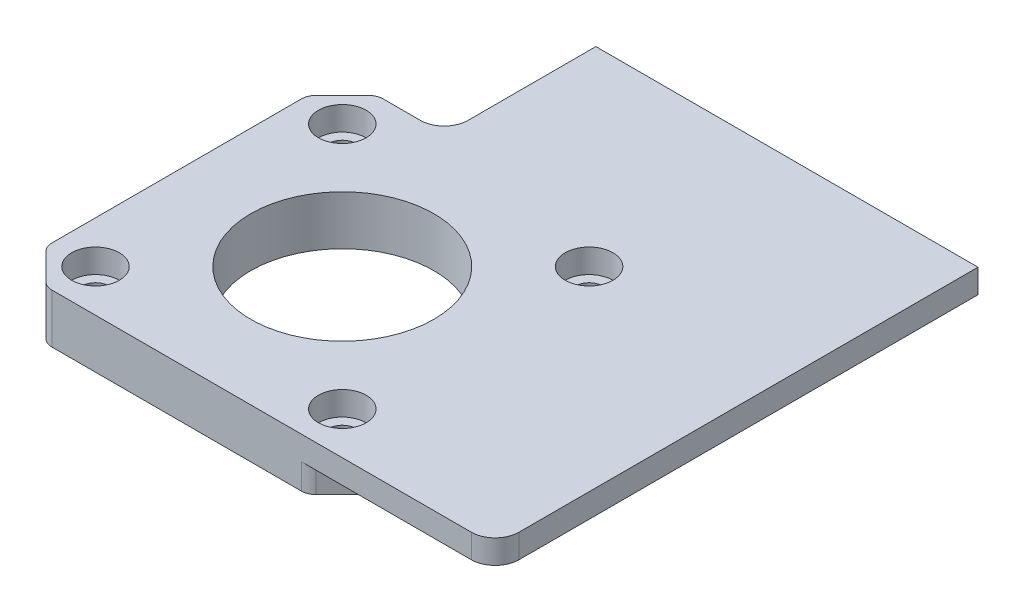
from build123d import *

# Parameters (mm, degrees)
SKETCH1_R           = 11.5
SKETCH1_R_2         = 1.75
BOSS_EXTRUDE1_DEPTH = 3.2
BOSS_EXTRUDE2_START = 3.2
SKETCH1_5_R         = 2.55
SKETCH1_5_R_2       = 11.5
SKETCH1_5_R_3       = 1.75
BOSS_EXTRUDE2_DEPTH = 3
BOSS_EXTRUDE3_START = 5
SKETCH1_6_R         = 2.55
BOSS_EXTRUDE3_DEPTH = 1.2
CUT_EXTRUDE2_START  = 3.2
SKETCH1_4_R         = 3
CUT_EXTRUDE2_DEPTH  = 3
FILLET1_R           = 3


with BuildPart() as part:
    # Sketch1 → Boss-Extrude1 (new body)
    with BuildSketch(Plane(origin=(0, -68.726755499, 0), x_dir=(1, 0, 0), z_dir=(0, 1, 0))):
        with BuildLine():
            Line((100.657671875, -32.65), (132.000817625, -32.65))
            ThreePointArc((132.000817625, -32.65), (132.689647804, -32.512983159), (133.273609832, -32.122792206))
            Line((133.273609832, -32.122792206), (136.602036956, -28.794365081))
            ThreePointArc((136.602036956, -28.794365081), (136.992227909, -28.210403054), (137.12924475, -27.521572875))
            Line((137.12924475, -27.521572875), (137.12924475, 3.821572875))
            ThreePointArc((137.12924475, 3.821572875), (136.992227909, 4.510403054), (136.602036956, 5.094365081))
            Line((136.602036956, 5.094365081), (133.273609832, 8.422792206))
            ThreePointArc((133.273609832, 8.422792206), (132.689647804, 8.812983159), (132.000817625, 8.95))
            Line((132.000817625, 8.95), (100.657671875, 8.95))
            ThreePointArc((100.657671875, 8.95), (99.968841697, 8.812983159), (99.384879669, 8.422792206))
            Line((99.384879669, 8.422792206), (96.056452544, 5.094365081))
            ThreePointArc((96.056452544, 5.094365081), (95.666261592, 4.510403054), (95.52924475, 3.821572875))
            Line((95.52924475, 3.821572875), (95.52924475, -27.521572875))
            ThreePointArc((95.52924475, -27.521572875), (95.666261592, -28.210403054), (96.056452544, -28.794365081))
            Line((96.056452544, -28.794365081), (99.384879669, -32.122792206))
            ThreePointArc((99.384879669, -32.122792206), (99.968841697, -32.512983159), (100.657671875, -32.65))
        make_face()
        with Locations((116.32924475, -11.85)):
            Circle(SKETCH1_R, mode=Mode.SUBTRACT)
        with Locations((100.82924475, -27.35)):
            Circle(SKETCH1_R_2, mode=Mode.SUBTRACT)
        with Locations((100.82924475, 3.65)):
            Circle(SKETCH1_R_2, mode=Mode.SUBTRACT)
        with Locations((131.82924475, 3.65)):
            Circle(SKETCH1_R_2, mode=Mode.SUBTRACT)
        with Locations((131.82924475, -27.35)):
            Circle(SKETCH1_R_2, mode=Mode.SUBTRACT)
    extrude(amount=BOSS_EXTRUDE1_DEPTH)

    # Sketch1<5> → Boss-Extrude2 (add)
    with BuildSketch(Plane(origin=(0, -68.726755499, 0), x_dir=(1, 0, 0), z_dir=(0, 1, 0)).offset(BOSS_EXTRUDE2_START)):
        with BuildLine():
            Line((108.32924475, 8.95), (100.657671875, 8.95))
            ThreePointArc((100.657671875, 8.95), (99.968841697, 8.812983159), (99.384879669, 8.422792206))
            Line((99.384879669, 8.422792206), (96.056452544, 5.094365081))
            ThreePointArc((96.056452544, 5.094365081), (95.666261592, 4.510403054), (95.52924475, 3.821572875))
            Line((95.52924475, 3.821572875), (95.52924475, -27.521572875))
            ThreePointArc((95.52924475, -27.521572875), (95.666261592, -28.210403054), (96.056452544, -28.794365081))
            Line((96.056452544, -28.794365081), (99.384879669, -32.122792206))
            ThreePointArc((99.384879669, -32.122792206), (99.968841697, -32.512983159), (100.657671875, -32.65))
            Line((100.657671875, -32.65), (156.32924475, -32.65))
            Line((156.32924475, -32.65), (156.32924475, 28))
            Line((156.32924475, 28), (108.32924475, 28))
            Line((108.32924475, 28), (108.32924475, 8.95))
        make_face()
        with Locations((144.32924475, -16)):
            Circle(SKETCH1_5_R, mode=Mode.SUBTRACT)
        with Locations((152.32924475, -16)):
            Circle(SKETCH1_5_R, mode=Mode.SUBTRACT)
        with Locations((144.32924475, -8)):
            Circle(SKETCH1_5_R, mode=Mode.SUBTRACT)
        with Locations((152.32924475, -8)):
            Circle(SKETCH1_5_R, mode=Mode.SUBTRACT)
        with Locations((120.32924475, 16)):
            Circle(SKETCH1_5_R, mode=Mode.SUBTRACT)
        with Locations((120.32924475, 24)):
            Circle(SKETCH1_5_R, mode=Mode.SUBTRACT)
        with Locations((144.32924475, 0)):
            Circle(SKETCH1_5_R, mode=Mode.SUBTRACT)
        with Locations((152.32924475, 0)):
            Circle(SKETCH1_5_R, mode=Mode.SUBTRACT)
        with Locations((144.32924475, 8)):
            Circle(SKETCH1_5_R, mode=Mode.SUBTRACT)
        with Locations((152.32924475, 8)):
            Circle(SKETCH1_5_R, mode=Mode.SUBTRACT)
        with Locations((128.32924475, 16)):
            Circle(SKETCH1_5_R, mode=Mode.SUBTRACT)
        with Locations((136.32924475, 16)):
            Circle(SKETCH1_5_R, mode=Mode.SUBTRACT)
        with Locations((128.32924475, 24)):
            Circle(SKETCH1_5_R, mode=Mode.SUBTRACT)
        with Locations((136.32924475, 24)):
            Circle(SKETCH1_5_R, mode=Mode.SUBTRACT)
        with Locations((144.32924475, 16)):
            Circle(SKETCH1_5_R, mode=Mode.SUBTRACT)
        with Locations((152.32924475, 16)):
            Circle(SKETCH1_5_R, mode=Mode.SUBTRACT)
        with Locations((144.32924475, 24)):
            Circle(SKETCH1_5_R, mode=Mode.SUBTRACT)
        with Locations((152.32924475, 24)):
            Circle(SKETCH1_5_R, mode=Mode.SUBTRACT)
        with Locations((116.32924475, -11.85)):
            Circle(SKETCH1_5_R_2, mode=Mode.SUBTRACT)
        with Locations((112.32924475, 24)):
            Circle(SKETCH1_5_R, mode=Mode.SUBTRACT)
        with Locations((112.32924475, 16)):
            Circle(SKETCH1_5_R, mode=Mode.SUBTRACT)
        with Locations((100.82924475, -27.35)):
            Circle(SKETCH1_5_R_3, mode=Mode.SUBTRACT)
        with Locations((100.82924475, 3.65)):
            Circle(SKETCH1_5_R_3, mode=Mode.SUBTRACT)
        with Locations((131.82924475, 3.65)):
            Circle(SKETCH1_5_R_3, mode=Mode.SUBTRACT)
        with Locations((131.82924475, -27.35)):
            Circle(SKETCH1_5_R_3, mode=Mode.SUBTRACT)
    extrude(amount=BOSS_EXTRUDE2_DEPTH)

    # Sketch1<6> → Boss-Extrude3 (add)
    with BuildSketch(Plane(origin=(0, -68.726755499, 0), x_dir=(1, 0, 0), z_dir=(0, 1, 0)).offset(BOSS_EXTRUDE3_START)):
        with Locations((152.32924475, -16)):
            Circle(SKETCH1_6_R)
        with Locations((144.32924475, -16)):
            Circle(SKETCH1_6_R)
        with Locations((144.32924475, -8)):
            Circle(SKETCH1_6_R)
        with Locations((152.32924475, -8)):
            Circle(SKETCH1_6_R)
        with Locations((152.32924475, 0)):
            Circle(SKETCH1_6_R)
        with Locations((144.32924475, 0)):
            Circle(SKETCH1_6_R)
        with Locations((152.32924475, 8)):
            Circle(SKETCH1_6_R)
        with Locations((152.32924475, 16)):
            Circle(SKETCH1_6_R)
        with Locations((144.32924475, 24)):
            Circle(SKETCH1_6_R)
        with Locations((152.32924475, 24)):
            Circle(SKETCH1_6_R)
        with Locations((136.32924475, 24)):
            Circle(SKETCH1_6_R)
        with Locations((136.32924475, 16)):
            Circle(SKETCH1_6_R)
        with Locations((128.32924475, 16)):
            Circle(SKETCH1_6_R)
        with Locations((128.32924475, 24)):
            Circle(SKETCH1_6_R)
        with Locations((120.32924475, 16)):
            Circle(SKETCH1_6_R)
        with Locations((120.32924475, 24)):
            Circle(SKETCH1_6_R)
        with Locations((144.32924475, 8)):
            Circle(SKETCH1_6_R)
        with Locations((144.32924475, 16)):
            Circle(SKETCH1_6_R)
        with Locations((112.32924475, 24)):
            Circle(SKETCH1_6_R)
        with Locations((112.32924475, 16)):
            Circle(SKETCH1_6_R)
    extrude(amount=BOSS_EXTRUDE3_DEPTH)

    # Sketch1<4> → Cut-Extrude2 (cut)
    with BuildSketch(Plane(origin=(0, -68.726755499, 0), x_dir=(1, 0, 0), z_dir=(0, 1, 0)).offset(CUT_EXTRUDE2_START)):
        with Locations((100.82924475, -27.35)):
            Circle(SKETCH1_4_R)
        with Locations((100.82924475, 3.65)):
            Circle(SKETCH1_4_R)
        with Locations((131.82924475, 3.65)):
            Circle(SKETCH1_4_R)
        with Locations((131.82924475, -27.35)):
            Circle(SKETCH1_4_R)
    extrude(amount=CUT_EXTRUDE2_DEPTH, mode=Mode.SUBTRACT)

    # Fillet1
    fillet1_edges = [part.edges().sort_by_distance(p)[0] for p in [
        (156.32924475, -64.026755499, 32.65),
        (108.32924475, -64.026755499, -8.95),
    ]]
    fillet(fillet1_edges, radius=FILLET1_R)


solid = part.part
